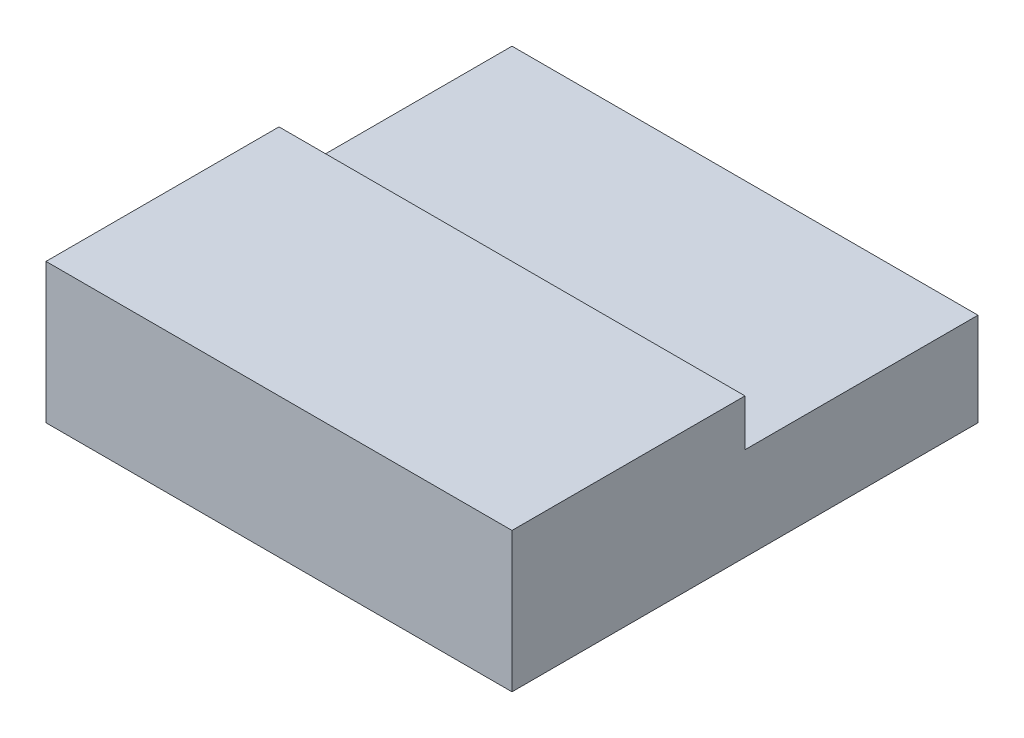
from build123d import *

# Parameters (mm, degrees)
SKETCH1_W           = 1
SKETCH1_H           = 1
BOSS_EXTRUDE1_DEPTH = 0.3
SKETCH2_W           = 1
SKETCH2_H           = 0.5
CUT_EXTRUDE1_DEPTH  = 0.1


with BuildPart() as part:
    # Sketch1 → Boss-Extrude1 (new body)
    with BuildSketch(Plane(origin=(0, 0, 0), x_dir=(1, 0, 0), z_dir=(0, 1, 0))):
        Rectangle(SKETCH1_W, SKETCH1_H)
    extrude(amount=BOSS_EXTRUDE1_DEPTH)

    # Sketch2 → Cut-Extrude1 (cut)
    with BuildSketch(Plane(origin=(0, 0.3, 0), x_dir=(1, 0, 0), z_dir=(0, 1, 0))):
        with Locations((0, 0.25)):
            Rectangle(SKETCH2_W, SKETCH2_H)
    extrude(amount=-CUT_EXTRUDE1_DEPTH, mode=Mode.SUBTRACT)


solid = part.part
